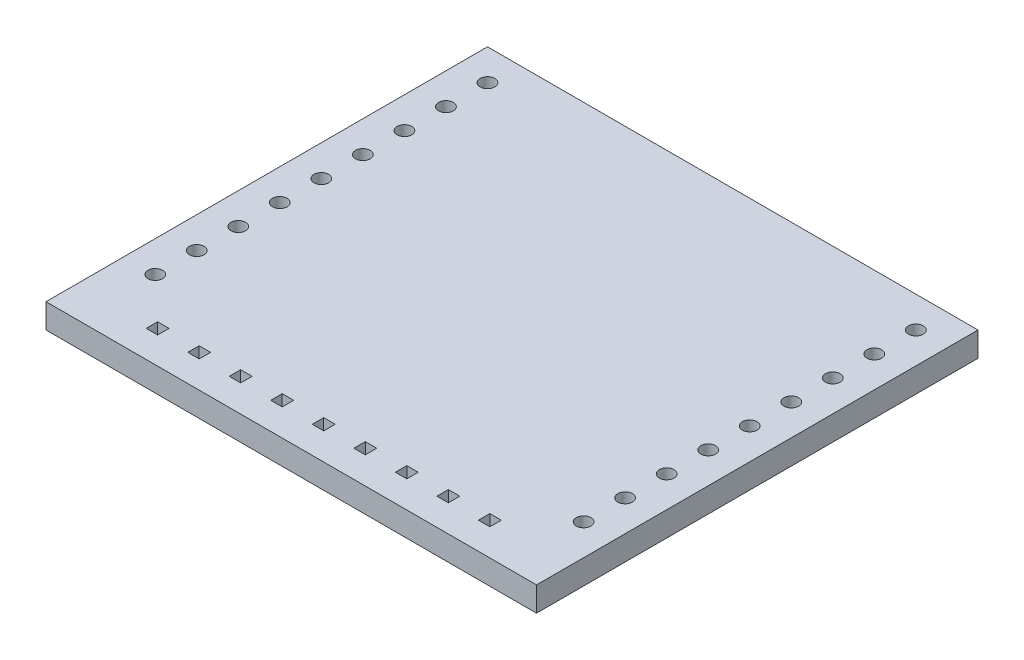
from build123d import *

# Parameters (mm, degrees)
SKETCH_1_W          = 30
SKETCH_1_H          = 27
EXTRUDE_1_DEPTH     = 1.5
SKETCH_2_R          = 0.45
SKETCH_2_W          = 0.7
SKETCH_2_H          = 0.7
CUT_EXTRUDE_1_DEPTH = 21.236106345


with BuildPart() as part:
    # Эскиз1 → Бобышка-Вытянуть1 (new body)
    with BuildSketch(Plane(origin=(0, 0, 0), x_dir=(1, 0, 0), z_dir=(0, 1, 0))):
        Rectangle(SKETCH_1_W, SKETCH_1_H)
    extrude(amount=EXTRUDE_1_DEPTH)

    # Эскиз2 → Вырез-Вытянуть1 (cut, through all)
    with BuildSketch(Plane(origin=(0, 1.5, 0), x_dir=(1, 0, 0), z_dir=(0, 1, 0))):
        with Locations(Location((-13.1, -8.72, 0), (0, 0, 270))):
            Circle(SKETCH_2_R)
        with Locations(Location((-13.1, -6.18, 0), (0, 0, 270))):
            Circle(SKETCH_2_R)
        with Locations(Location((-13.1, -3.64, 0), (0, 0, 270))):
            Circle(SKETCH_2_R)
        with Locations(Location((-13.1, -1.1, 0), (0, 0, 270))):
            Circle(SKETCH_2_R)
        with Locations(Location((-13.1, 1.44, 0), (0, 0, 270))):
            Circle(SKETCH_2_R)
        with Locations(Location((-13.1, 3.98, 0), (0, 0, 270))):
            Circle(SKETCH_2_R)
        with Locations(Location((-13.1, 6.52, 0), (0, 0, 270))):
            Circle(SKETCH_2_R)
        with Locations(Location((-13.1, 9.06, 0), (0, 0, 270))):
            Circle(SKETCH_2_R)
        with Locations(Location((-13.1, 11.6, 0), (0, 0, 270))):
            Circle(SKETCH_2_R)
        with Locations(Location((13.1, 11.6, 0), (0, 0, 90))):
            Circle(SKETCH_2_R)
        with Locations(Location((13.1, 9.06, 0), (0, 0, 90))):
            Circle(SKETCH_2_R)
        with Locations(Location((13.1, 6.52, 0), (0, 0, 90))):
            Circle(SKETCH_2_R)
        with Locations(Location((13.1, 3.98, 0), (0, 0, 90))):
            Circle(SKETCH_2_R)
        with Locations(Location((13.1, 1.44, 0), (0, 0, 90))):
            Circle(SKETCH_2_R)
        with Locations(Location((13.1, -1.1, 0), (0, 0, 90))):
            Circle(SKETCH_2_R)
        with Locations(Location((13.1, -3.64, 0), (0, 0, 90))):
            Circle(SKETCH_2_R)
        with Locations(Location((13.1, -6.18, 0), (0, 0, 90))):
            Circle(SKETCH_2_R)
        with Locations(Location((13.1, -8.72, 0), (0, 0, 90))):
            Circle(SKETCH_2_R)
        with Locations((-10.174, -11.5)):
            Rectangle(SKETCH_2_W, SKETCH_2_H)
        with Locations((-7.634, -11.5)):
            Rectangle(SKETCH_2_W, SKETCH_2_H)
        with Locations((-5.094, -11.5)):
            Rectangle(SKETCH_2_W, SKETCH_2_H)
        with Locations((-2.554, -11.5)):
            Rectangle(SKETCH_2_W, SKETCH_2_H)
        with Locations((-0.014, -11.5)):
            Rectangle(SKETCH_2_W, SKETCH_2_H)
        with Locations((2.526, -11.5)):
            Rectangle(SKETCH_2_W, SKETCH_2_H)
        with Locations((5.066, -11.5)):
            Rectangle(SKETCH_2_W, SKETCH_2_H)
        with Locations((7.606, -11.5)):
            Rectangle(SKETCH_2_W, SKETCH_2_H)
        with Locations((10.146, -11.5)):
            Rectangle(SKETCH_2_W, SKETCH_2_H)
    extrude(amount=-CUT_EXTRUDE_1_DEPTH, mode=Mode.SUBTRACT)


solid = part.part
